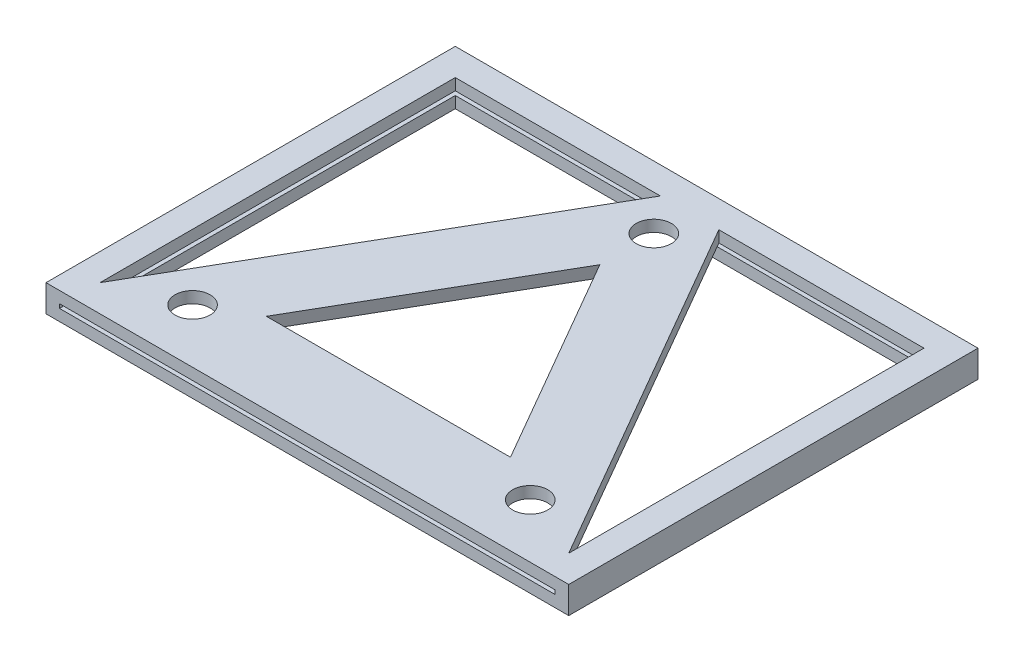
from build123d import *

# Parameters (mm, degrees)
SKETCH1_R           = 6.5
BOSS_EXTRUDE1_DEPTH = 5
SKETCH1_8_W         = 193.5
SKETCH1_8_H         = 151.5
BOSS_EXTRUDE2_DEPTH = 5
SKETCH2_W           = 183.5
SKETCH2_H           = 146.5
CUT_EXTRUDE2_DEPTH  = 0.75


with BuildPart() as part:
    # Sketch1 → Boss-Extrude1 (new body)
    with BuildSketch(Plane(origin=(0, 0, 0), x_dir=(1, 0, 0), z_dir=(0, 1, 0))):
        Polygon((10.828439602, 85.415608176), (-10.828439602, 85.415608176), (-86.75, -46.084391824), (86.75, -46.084391824), align=None)
        with Locations((-62.5, -36.084391824)):
            Circle(SKETCH1_R, mode=Mode.SUBTRACT)
        with Locations((62.5, -36.084391824)):
            Circle(SKETCH1_R, mode=Mode.SUBTRACT)
        Polygon((-45.179491924, -26.084391824), (0, 52.168783649), (45.179491924, -26.084391824), align=None, mode=Mode.SUBTRACT)
        with Locations((0, 72.168783649)):
            Circle(SKETCH1_R, mode=Mode.SUBTRACT)
    extrude(amount=BOSS_EXTRUDE1_DEPTH)

    # Sketch1<8> → Boss-Extrude2 (add, symmetric)
    with BuildSketch(Plane(origin=(0, 0, 0), x_dir=(1, 0, 0), z_dir=(0, 1, 0))):
        with Locations((0, 19.665608176)):
            Rectangle(SKETCH1_8_W, SKETCH1_8_H)
        Polygon((-86.75, 85.415608176), (-10.828439602, 85.415608176), (10.828439602, 85.415608176), (86.75, 85.415608176), (86.75, -46.084391824), (-86.75, -46.084391824), align=None, mode=Mode.SUBTRACT)
    extrude(amount=BOSS_EXTRUDE2_DEPTH, both=True)

    # Sketch2 → Cut-Extrude2 (cut, symmetric)
    with BuildSketch(Plane(origin=(0, 0, 0), x_dir=(1, 0, 0), z_dir=(0, 1, 0))):
        with Locations((0, 17.165608176)):
            Rectangle(SKETCH2_W, SKETCH2_H)
    extrude(amount=CUT_EXTRUDE2_DEPTH, both=True, mode=Mode.SUBTRACT)


solid = part.part
